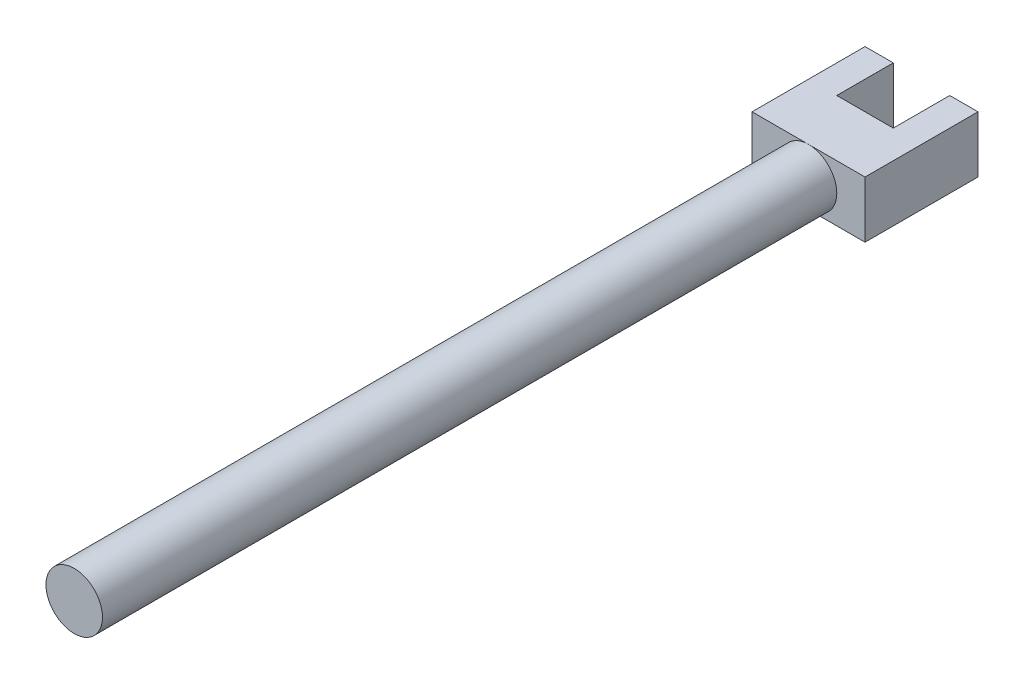
from build123d import *

# Parameters (mm, degrees)
SKETCH1_R           = 5
BOSS_EXTRUDE1_DEPTH = 130
SKETCH2_W           = 20
SKETCH2_H           = 10
BOSS_EXTRUDE2_DEPTH = 10
SKETCH3_W           = 5
SKETCH3_H           = 10
BOSS_EXTRUDE3_DEPTH = 10
SKETCH4_W           = 5
SKETCH4_H           = 10
BOSS_EXTRUDE4_DEPTH = 10


with BuildPart() as part:
    # Sketch1 → Boss-Extrude1 (new body)
    with BuildSketch(Plane.XY):
        Circle(SKETCH1_R)
    extrude(amount=BOSS_EXTRUDE1_DEPTH)

    # Sketch2 → Boss-Extrude2 (add)
    with BuildSketch(Plane(origin=(0, 0, 0), x_dir=(-1, 0, 0), z_dir=(0, 0, -1))):
        Rectangle(SKETCH2_W, SKETCH2_H)
    extrude(amount=BOSS_EXTRUDE2_DEPTH)

    # Sketch3 → Boss-Extrude3 (add)
    with BuildSketch(Plane(origin=(0, 0, -10), x_dir=(-1, 0, 0), z_dir=(0, 0, -1))):
        with Locations((-7.5, 0)):
            Rectangle(SKETCH3_W, SKETCH3_H)
    extrude(amount=BOSS_EXTRUDE3_DEPTH)

    # Sketch4 → Boss-Extrude4 (add)
    with BuildSketch(Plane(origin=(0, 0, -10), x_dir=(-1, 0, 0), z_dir=(0, 0, -1))):
        with Locations((7.5, 0)):
            Rectangle(SKETCH4_W, SKETCH4_H)
    extrude(amount=BOSS_EXTRUDE4_DEPTH)


solid = part.part
